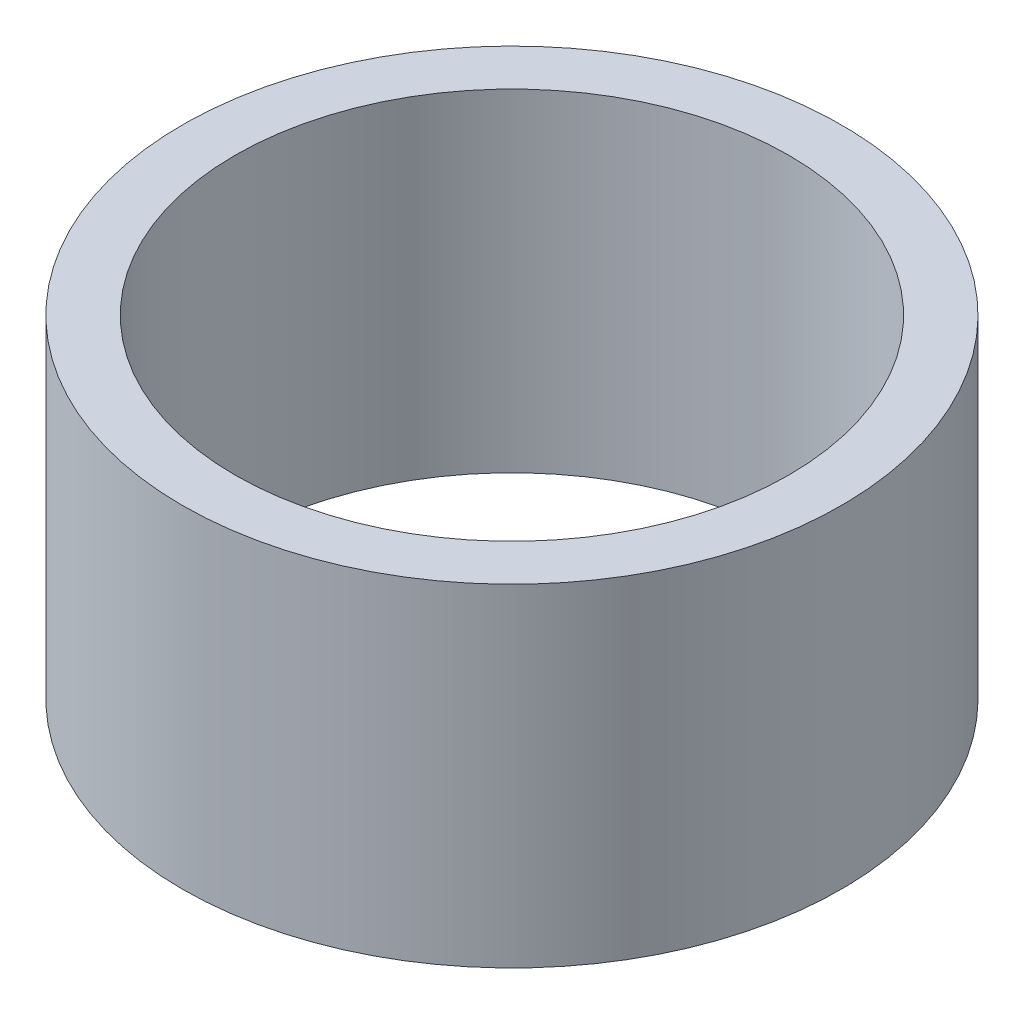
from build123d import *

# Parameters (mm, degrees)
SKETCH1_W          = 14.875
SKETCH1_H          = 15
SKETCH2_R          = 12.5
CUT_EXTRUDE1_DEPTH = 26.836626134


with BuildPart() as part:
    # Sketch1 → Revolve1 (revolve)
    with BuildSketch(Plane.XY):
        with Locations((7.4375, -7.5)):
            Rectangle(SKETCH1_W, SKETCH1_H)
    revolve(axis=Axis((0, 0, 0), (0, -1, 0)))

    # Sketch2 → Cut-Extrude1 (cut, through all)
    with BuildSketch(Plane(origin=(0, 0, 0), x_dir=(1, 0, 0), z_dir=(0, 1, 0))):
        Circle(SKETCH2_R)
    extrude(amount=-CUT_EXTRUDE1_DEPTH, mode=Mode.SUBTRACT)


solid = part.part
